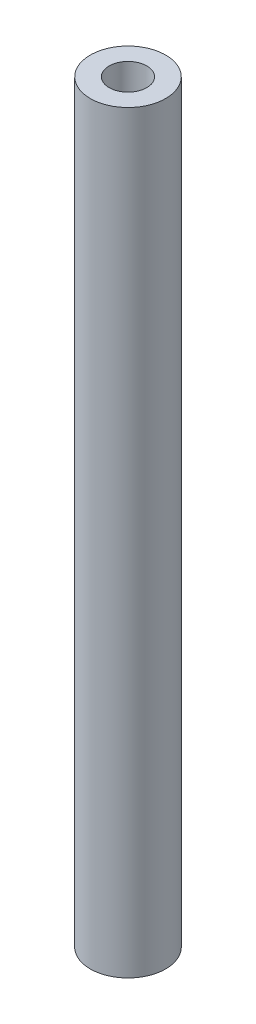
from build123d import *

# Parameters (mm, degrees)
SKETCH1_R           = 3
SKETCH1_R_2         = 1.5
BOSS_EXTRUDE1_DEPTH = 60


with BuildPart() as part:
    # Sketch1 → Boss-Extrude1 (new body)
    with BuildSketch(Plane(origin=(0, 0, 0), x_dir=(1, 0, 0), z_dir=(0, 1, 0))):
        with Locations(Location((0, 0, 0), (0, 0, 270))):
            Circle(SKETCH1_R)
        with Locations(Location((0, 0, 0), (0, 0, 270))):
            Circle(SKETCH1_R_2, mode=Mode.SUBTRACT)
    extrude(amount=BOSS_EXTRUDE1_DEPTH)


solid = part.part
